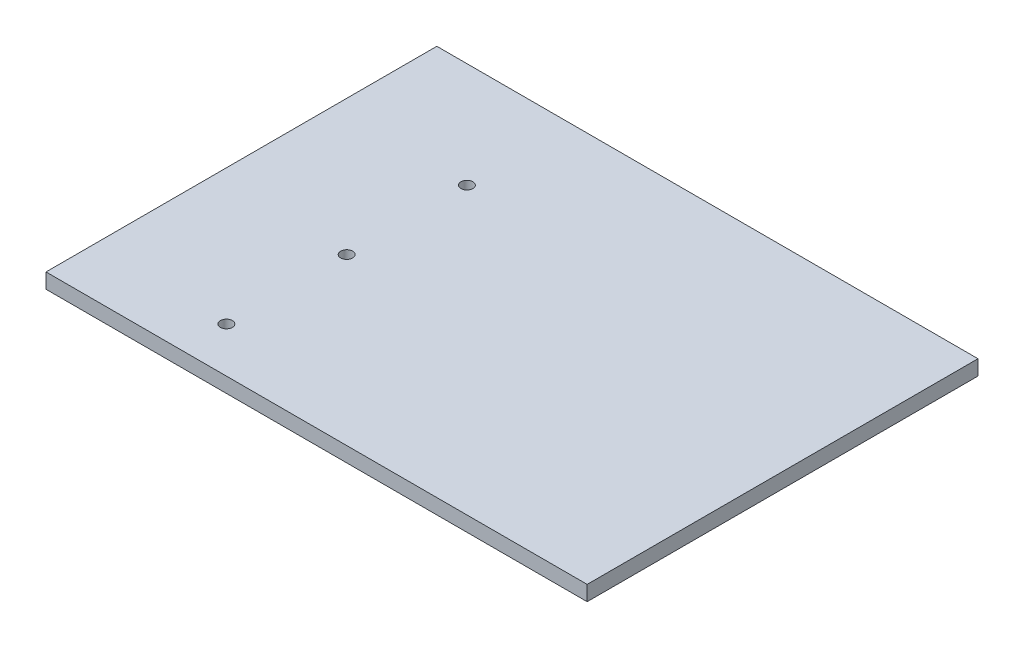
from build123d import *

# Parameters (mm, degrees)
SKETCH1_W               = 457.2
SKETCH1_H               = 330.2
BOSS_EXTRUDE1_DEPTH     = 12.7
F_3_8_CLEARANCE_HOLE1_D = 10.0838


with BuildPart() as part:
    # Sketch1 → Boss-Extrude1 (new body)
    with BuildSketch(Plane(origin=(0, 0, 0), x_dir=(1, 0, 0), z_dir=(0, 1, 0))):
        Rectangle(SKETCH1_W, SKETCH1_H)
    extrude(amount=BOSS_EXTRUDE1_DEPTH)

    # 3/8 Clearance Hole1 (through all)
    with Locations(Plane(origin=(0, 12.7, -165.1), x_dir=(1, 0, 0), z_dir=(0, 1, 0))):
        with Locations((-114.300000003, -88.9), (-114.300000003, -190.5), (-114.300000003, -292.1)):
            Hole(F_3_8_CLEARANCE_HOLE1_D / 2)


solid = part.part
